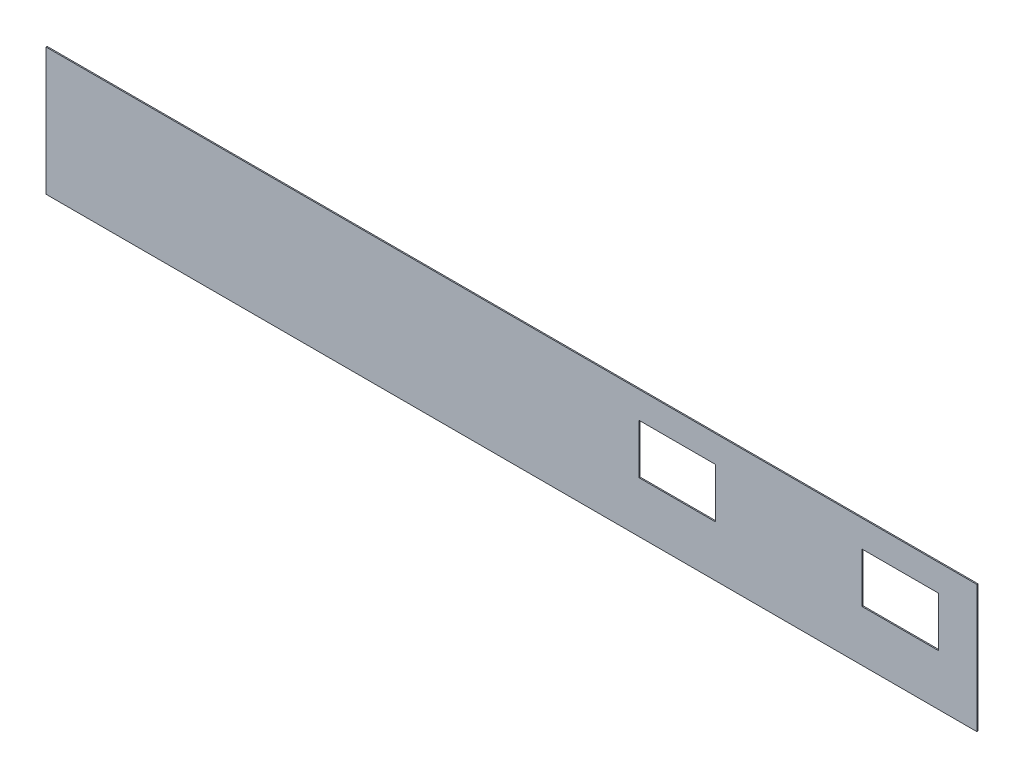
from build123d import *

# Parameters (mm, degrees)
SKETCH1_W           = 6
SKETCH1_H           = 3.9
BOSS_EXTRUDE1_DEPTH = 0.09


with BuildPart() as part:
    # Sketch1 → Boss-Extrude1 (new body)
    with BuildSketch(Plane.XY):
        Polygon((96, 0), (30, 0), (23, 0), (23, 10), (30, 10), (96, 10), align=None)
        with Locations((90, 5.95)):
            Rectangle(SKETCH1_W, SKETCH1_H, mode=Mode.SUBTRACT)
        with Locations((72.5, 5.95)):
            Rectangle(SKETCH1_W, SKETCH1_H, mode=Mode.SUBTRACT)
    extrude(amount=BOSS_EXTRUDE1_DEPTH)


solid = part.part
